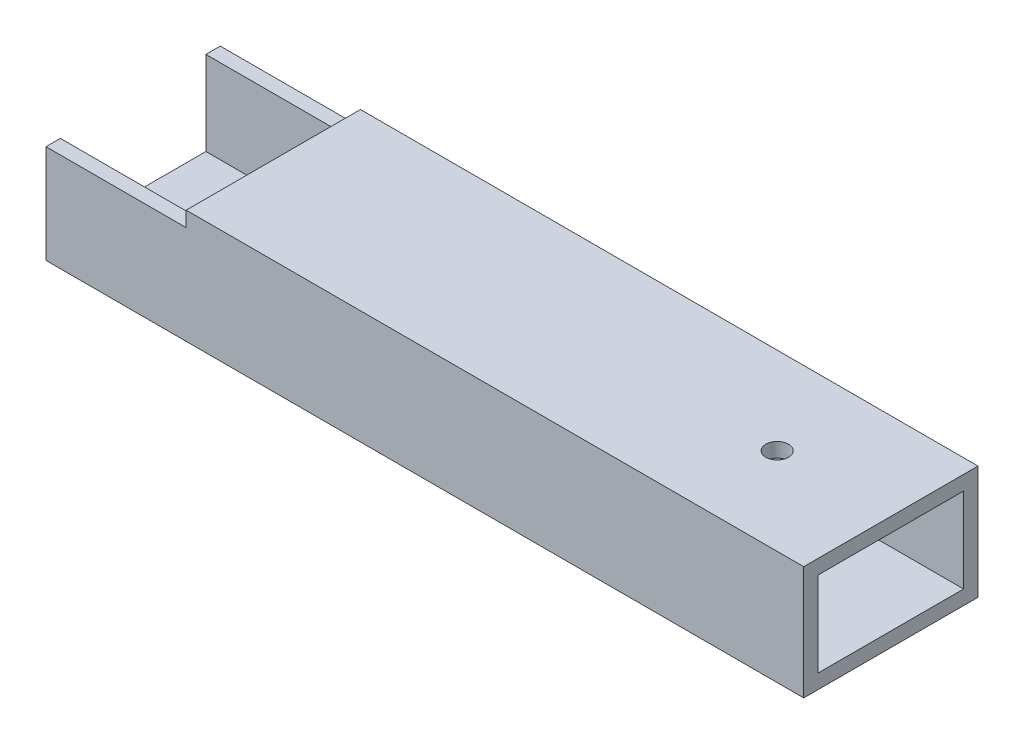
from build123d import *

# Parameters (mm, degrees)
SKETCH_1_W          = 100
SKETCH_1_H          = 19
SKETCH_1_R          = 1.5
EXTRUDE_2_DEPTH     = 2
SKETCH_2_W          = 100
SKETCH_2_H          = 2
EXTRUDE_3_DEPTH     = 15
SKETCH_3_W          = 100
SKETCH_3_H          = 19
SKETCH_3_R          = 1.5
EXTRUDE_5_DEPTH     = 2
CUT_EXTRUDE_1_DEPTH = 2
SKETCH_7_W          = 19
SKETCH_7_H          = 11
CUT_EXTRUDE_2_DEPTH = 100
CUT_EXTRUDE_3_DEPTH = 2


with BuildPart() as part:
    # 草图1 → 凸台-拉伸2 (new body)
    with BuildSketch(Plane(origin=(0, 0, 0), x_dir=(1, 0, 0), z_dir=(0, 1, 0))):
        Rectangle(SKETCH_1_W, SKETCH_1_H)
        with Locations(Location((-35, 0, 0), (0, 0, 270))):
            Circle(SKETCH_1_R, mode=Mode.SUBTRACT)
        with Locations(Location((35, 0, 0), (0, 0, 270))):
            Circle(SKETCH_1_R, mode=Mode.SUBTRACT)
    extrude(amount=EXTRUDE_2_DEPTH)

    # 草图2 → 凸台-拉伸3 (add)
    with BuildSketch(Plane(origin=(0, 2, 0), x_dir=(1, 0, 0), z_dir=(0, 1, 0))):
        with Locations((0, -10.5)):
            Rectangle(SKETCH_2_W, SKETCH_2_H)
        with Locations((0, 10.5)):
            Rectangle(SKETCH_2_W, SKETCH_2_H)
    extrude(amount=-EXTRUDE_3_DEPTH)

    # 草图3 → 凸台-拉伸5 (add)
    with BuildSketch(Plane(origin=(0, -13, 0), x_dir=(-1, 0, 0), z_dir=(0, -1, 0))):
        Rectangle(SKETCH_3_W, SKETCH_3_H)
        with Locations(Location((35, 0, 0), (0, 0, 270))):
            Circle(SKETCH_3_R, mode=Mode.SUBTRACT)
        with Locations(Location((-35, 0, 0), (0, 0, 270))):
            Circle(SKETCH_3_R, mode=Mode.SUBTRACT)
    extrude(amount=-EXTRUDE_5_DEPTH)

    # 草图5 → 切除-拉伸1 (cut)
    with BuildSketch(Plane(origin=(0, 2, 0), x_dir=(1, 0, 0), z_dir=(0, 1, 0))):
        Polygon((-38.5, -11.5), (-38.5, 0), (-38.5, 11.5), (-50, 11.5), (-50, -11.5), align=None)
    extrude(amount=-CUT_EXTRUDE_1_DEPTH, mode=Mode.SUBTRACT)

    # 草图7 → 切除-拉伸2 (cut)
    with BuildSketch(Plane(origin=(50, 0, 0), x_dir=(0, 0, -1), z_dir=(1, 0, 0))):
        Polygon((9.5, 0), (9.5, -11), (9.6, -11), (9.6, 0.1), (-9.5, 0.1), (-9.5, 0), align=None)
        with Locations((0, -5.5)):
            Rectangle(SKETCH_7_W, SKETCH_7_H)
        Polygon((-9.6, 0.1), (-9.6, -11.1), (9.6, -11.1), (9.6, -11), (9.5, -11), (-9.5, -11), (-9.5, 0), (-9.5, 0.1), align=None)
    extrude(amount=-CUT_EXTRUDE_2_DEPTH, mode=Mode.SUBTRACT)

    # 草图8 → 切除-拉伸3 (cut)
    with BuildSketch(Plane(origin=(0, 2, 0), x_dir=(1, 0, 0), z_dir=(0, 1, 0))):
        Polygon((-31.5, -11.5), (-31.5, 0), (-31.5, 11.5), (-38.5, 11.5), (-38.5, -11.5), align=None)
    extrude(amount=-CUT_EXTRUDE_3_DEPTH, mode=Mode.SUBTRACT)


solid = part.part
